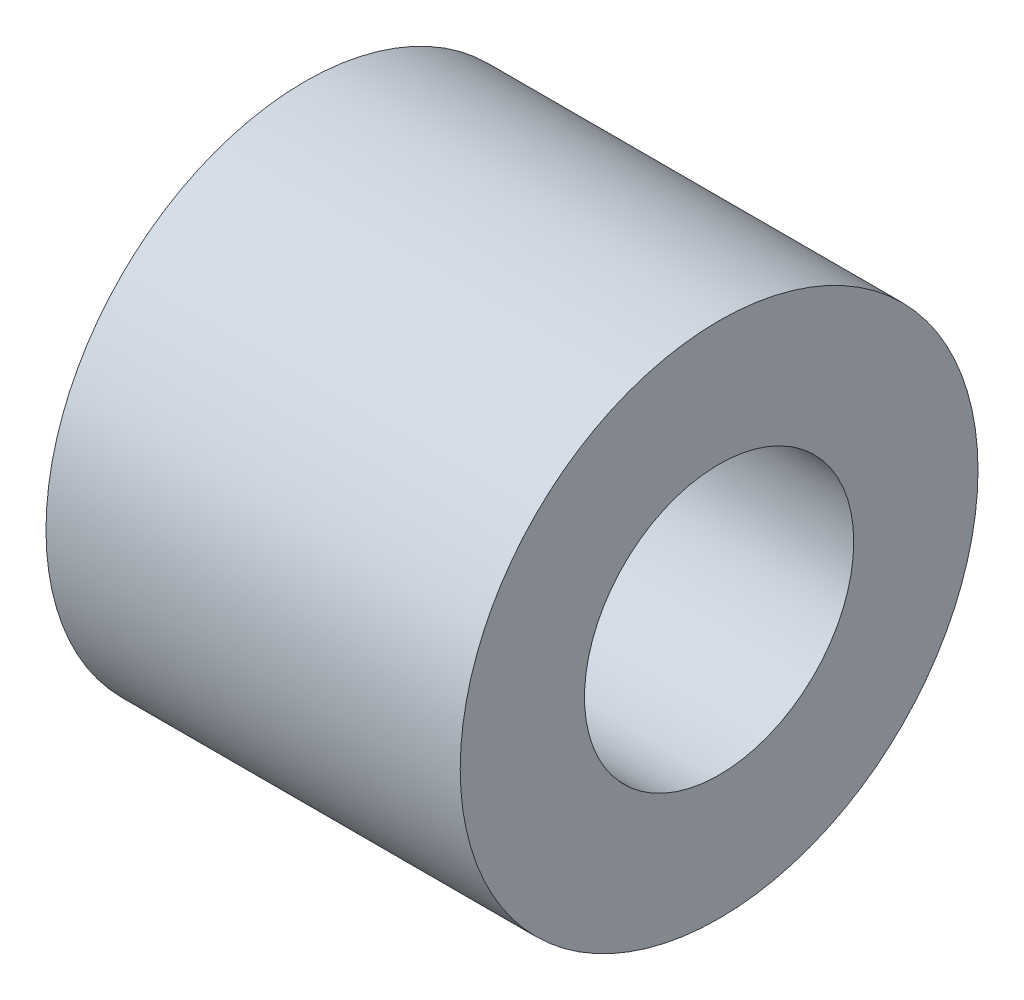
from build123d import *

# Parameters (mm, degrees)
SKETCH1_R           = 6.35
SKETCH1_R_2         = 3.302
BOSS_EXTRUDE1_DEPTH = 10.16


with BuildPart() as part:
    # Sketch1 → Boss-Extrude1 (new body)
    with BuildSketch(Plane(origin=(0, 0, 0), x_dir=(0, 0, -1), z_dir=(1, 0, 0))):
        Circle(SKETCH1_R)
        Circle(SKETCH1_R_2, mode=Mode.SUBTRACT)
    extrude(amount=BOSS_EXTRUDE1_DEPTH)


solid = part.part
